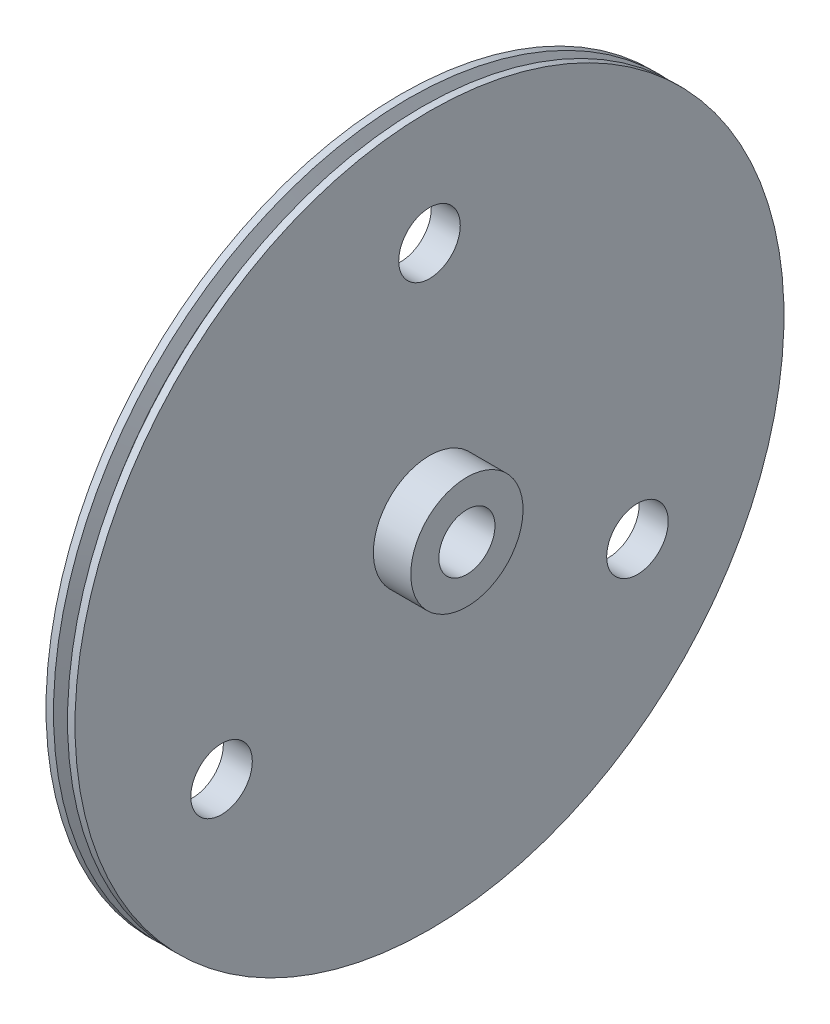
from build123d import *

# Parameters (mm, degrees)
SKETCH3_R          = 19.05
CUT_EXTRUDE1_DEPTH = 344.324834049
SKETCH4_R          = 20.893502845
CUT_EXTRUDE2_DEPTH = 344.324834049


with BuildPart() as part:
    # Sketch2 → Revolve1 (revolve)
    with BuildSketch(Plane.XY):
        Polygon((0, 0), (0, 240.665), (5.08, 240.665), (8.781317037, 232.7275), (10.903682963, 232.7275), (14.605, 240.665), (19.685, 240.665), (19.685, 38.1), (45.085, 38.1), (45.085, 0), align=None)
    revolve(axis=Axis((45.085, 0, 0), (-1, 0, 0)))

    # Sketch3 → Cut-Extrude1 (cut, through all)
    with BuildSketch(Plane(origin=(45.085, 0, 0), x_dir=(0, 0, -1), z_dir=(1, 0, 0))):
        with Locations(Location((0, 0, 0), (0, 0, 90))):
            Circle(SKETCH3_R)
    extrude(amount=-CUT_EXTRUDE1_DEPTH, mode=Mode.SUBTRACT)

    # Sketch4 → Cut-Extrude2 (cut, through all)
    with BuildSketch(Plane.ZY):
        with Locations(Location((0, 163.022805962, 0), (0, 0, 270))):
            Circle(SKETCH4_R)
        with Locations(Location((141.181891359, -81.511402981, 0), (0, 0, 270))):
            Circle(SKETCH4_R)
        with Locations(Location((-141.181891359, -81.511402981, 0), (0, 0, 270))):
            Circle(SKETCH4_R)
    extrude(amount=-CUT_EXTRUDE2_DEPTH, mode=Mode.SUBTRACT)


solid = part.part
